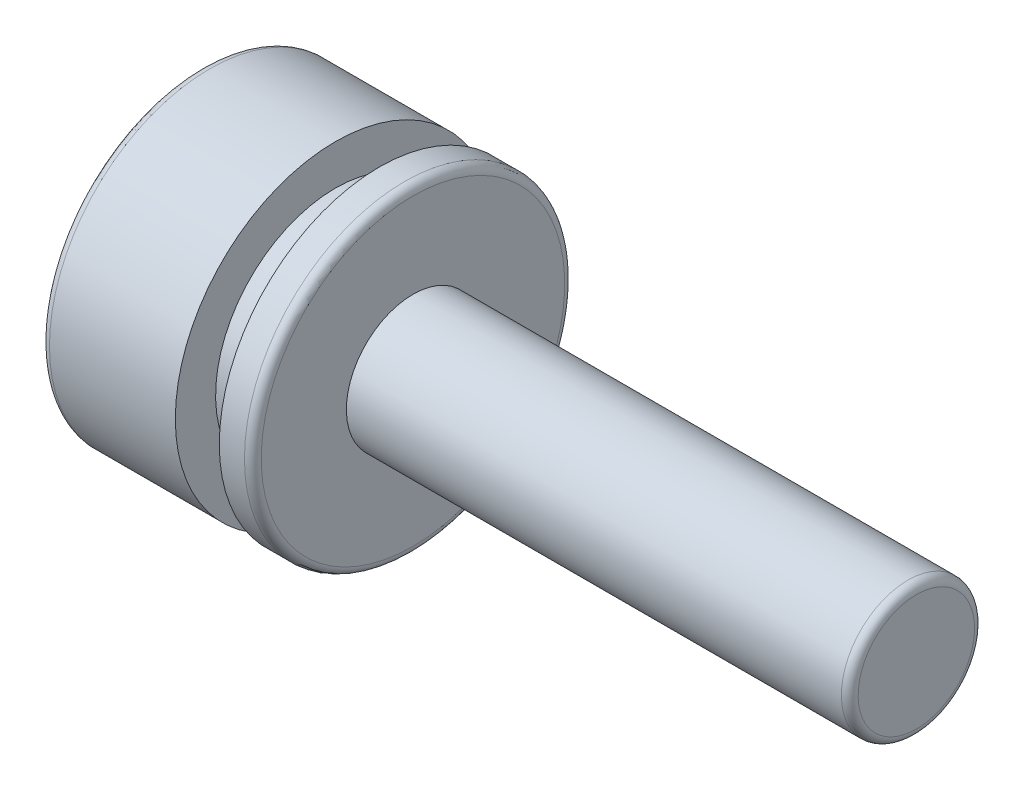
from build123d import *

# Parameters (mm, degrees)
FILETE1_R = 0.5
FILETE2_R = 0.5
FILETE3_R = 0.5
FILETE4_R = 0.5


with BuildPart() as part:
    # Esboço1 → Revolução1 (revolve)
    with BuildSketch(Plane.XY):
        Polygon((0, 5), (0, 9.54375), (8, 9.54375), (8, 7.14375), (10.62, 7.14375), (10.62, 9.54375), (12.62, 9.54375), (12.62, 3.96875), (42.62, 3.96875), (42.62, 0), (9.386751346, 0), (6.5, 5), align=None)
    revolve(axis=Axis((42.62, 0, 0), (-1, 0, 0)))

    # Filete1
    filete1_edges = [part.edges().sort_by_distance(p)[0] for p in [
        (42.62, -3.96875, 0),
    ]]
    fillet(filete1_edges, radius=FILETE1_R)

    # Filete2
    filete2_edges = [part.edges().sort_by_distance(p)[0] for p in [
        (0, -5, 0),
    ]]
    fillet(filete2_edges, radius=FILETE2_R)

    # Filete3
    filete3_edges = [part.edges().sort_by_distance(p)[0] for p in [
        (0, -9.54375, 0),
    ]]
    fillet(filete3_edges, radius=FILETE3_R)

    # Filete4
    filete4_edges = [part.edges().sort_by_distance(p)[0] for p in [
        (12.62, -9.54375, 0),
    ]]
    fillet(filete4_edges, radius=FILETE4_R)


solid = part.part
